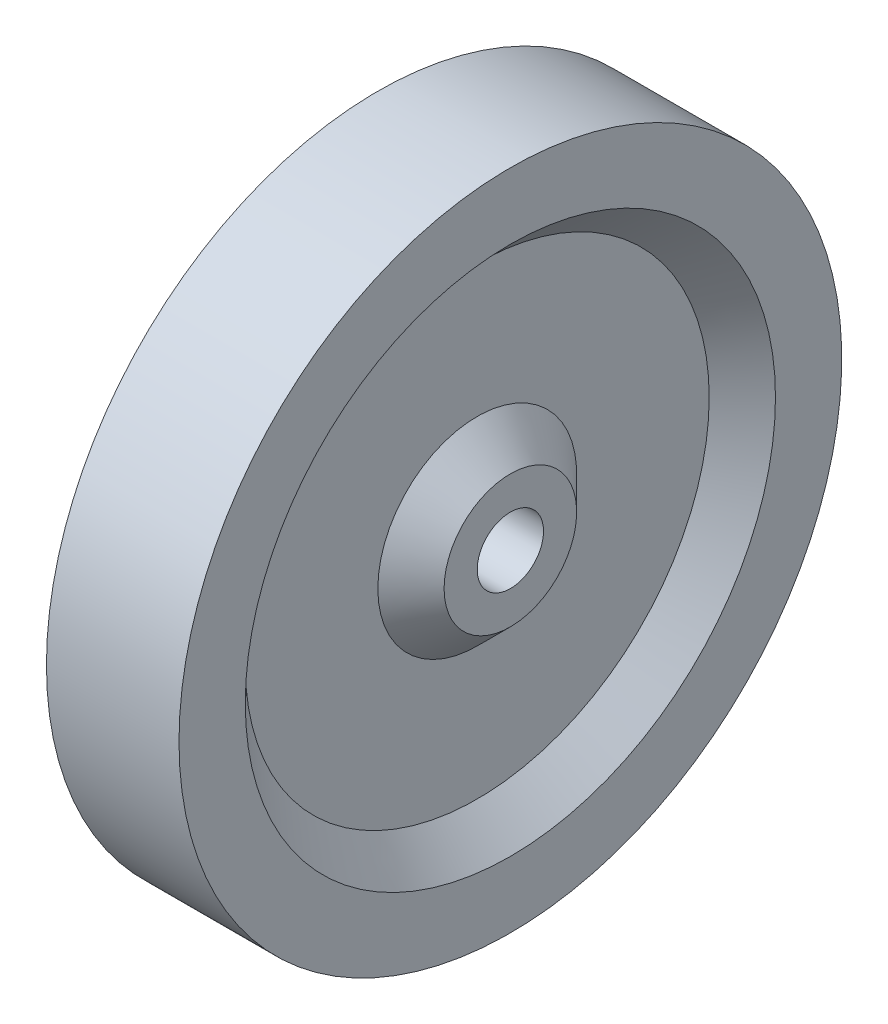
from build123d import *

# Parameters (mm, degrees)
SKETCH2_R          = 5
CUT_EXTRUDE1_DEPTH = 74.484692283


with BuildPart() as part:
    # Sketch1 → Revolve1 (revolve)
    with BuildSketch(Plane.XY):
        Polygon((-10, 10), (-10, 0), (10, 0), (10, 10), (5, 15), (5, 35), (10, 40), (10, 50), (-10, 50), (-10, 40), (-5, 35), (-5, 15), align=None)
    revolve(axis=Axis((-10, 0, 0), (1, 0, 0)))

    # Sketch2 → Cut-Extrude1 (cut, through all)
    with BuildSketch(Plane(origin=(10, 0, 0), x_dir=(0, 0, -1), z_dir=(1, 0, 0))):
        Circle(SKETCH2_R)
    extrude(amount=-CUT_EXTRUDE1_DEPTH, mode=Mode.SUBTRACT)


solid = part.part
